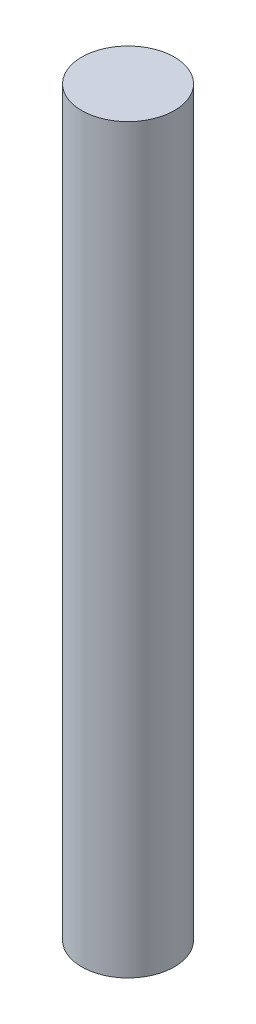
from build123d import *

# Parameters (mm, degrees)
SKETCH1_R           = 9.525
BOSS_EXTRUDE1_DEPTH = 76.2


with BuildPart() as part:
    # Sketch1 → Boss-Extrude1 (new, symmetric)
    with BuildSketch(Plane(origin=(0, 0, 0), x_dir=(1, 0, 0), z_dir=(0, 1, 0))):
        with Locations(Location((0, 0, 0), (0, 0, 90))):
            Circle(SKETCH1_R)
    extrude(amount=BOSS_EXTRUDE1_DEPTH, both=True)


solid = part.part
